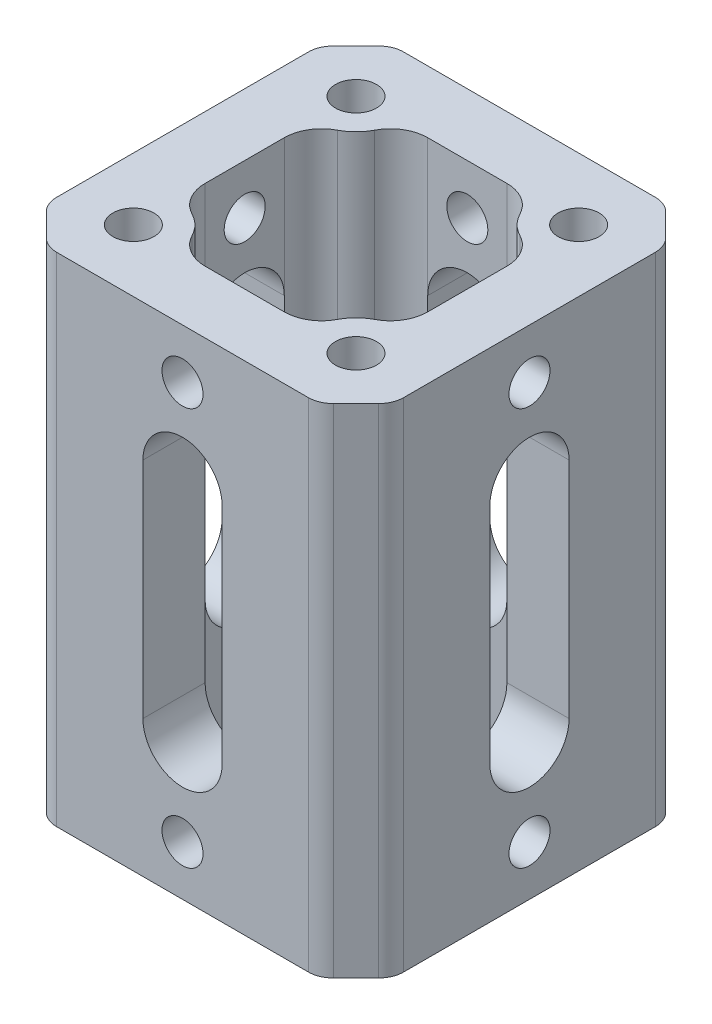
from build123d import *

# Parameters (mm, degrees)
SKETCH_1_W          = 27.9
SKETCH_1_H          = 27.9
EXTRUDE_1_DEPTH     = 20
HOLE_WIZARD_M4_2_D  = 3.3
CUT_EXTRUDE_1_DEPTH = 46
CHAMFER_1_SIZE      = 3
HOLE_WIZARD_M4_3_D  = 3.3
HOLE_WIZARD_M4_4_D  = 3.3
FILLET_1_R          = 2
FILLET_2_R          = 3
CUT_EXTRUDE_2_DEPTH = 46
CUT_EXTRUDE_3_DEPTH = 46


with BuildPart() as part:
    # 草图1 → 凸台-拉伸1 (new, symmetric)
    with BuildSketch(Plane(origin=(0, 0, 0), x_dir=(1, 0, 0), z_dir=(0, 1, 0))):
        Rectangle(SKETCH_1_W, SKETCH_1_H)
    extrude(amount=EXTRUDE_1_DEPTH, both=True)

    # M4 螺纹孔2 (through all)
    with Locations(Plane(origin=(0, -20, 0), x_dir=(-1, 0, 0), z_dir=(0, -1, 0))):
        with Locations((8.95, -8.95), (8.95, 8.95), (-8.95, 8.95), (-8.95, -8.95)):
            Hole(HOLE_WIZARD_M4_2_D / 2)

    # 草图8 → 切除-拉伸1 (cut, symmetric)
    with BuildSketch(Plane.XZ.offset(20)):
        with BuildLine():
            ThreePointArc((-8.95, -5.45), (-6.475126266, -6.475126266), (-5.45, -8.95))
            Line((-5.45, -8.95), (5.45, -8.95))
            ThreePointArc((5.45, -8.95), (6.475126266, -6.475126266), (8.95, -5.45))
            Line((8.95, -5.45), (8.95, 5.45))
            ThreePointArc((8.95, 5.45), (6.475126266, 6.475126266), (5.45, 8.95))
            Line((5.45, 8.95), (-5.45, 8.95))
            ThreePointArc((-5.45, 8.95), (-6.475126266, 6.475126266), (-8.95, 5.45))
            Line((-8.95, 5.45), (-8.95, -5.45))
        make_face()
    extrude(amount=CUT_EXTRUDE_1_DEPTH, both=True, mode=Mode.SUBTRACT)

    # 倒角1
    chamfer_1_edges = [part.edges().sort_by_distance(p)[0] for p in [
        (13.95, 0, 13.95),
        (-13.95, 0, 13.95),
        (-13.95, 0, -13.95),
        (13.95, 0, -13.95),
    ]]
    chamfer(chamfer_1_edges, length=CHAMFER_1_SIZE)

    # M4 螺纹孔3 (through all)
    with Locations(Plane.ZY.offset(13.95)):
        with Locations((0, 16), (0, -16)):
            Hole(HOLE_WIZARD_M4_3_D / 2)

    # M4 螺纹孔4 (through all)
    with Locations(Plane.XY.offset(13.95)):
        with Locations((0, 16), (0, -16)):
            Hole(HOLE_WIZARD_M4_4_D / 2)

    # 圆角1
    fillet_1_edges = [part.edges().sort_by_distance(p)[0] for p in [
        (-13.95, 0, 10.95),
        (-13.95, 0, -10.95),
        (13.95, 0, -10.95),
        (13.95, 0, 10.95),
        (-10.95, 0, 13.95),
        (10.95, 0, 13.95),
        (-10.95, 0, -13.95),
        (10.95, 0, -13.95),
    ]]
    fillet(fillet_1_edges, radius=FILLET_1_R)

    # 圆角2
    fillet_2_edges = [part.edges().sort_by_distance(p)[0] for p in [
        (-8.95, 0, 5.45),
        (-5.45, 0, 8.95),
        (5.45, 0, 8.95),
        (8.95, 0, 5.45),
        (8.95, 0, -5.45),
        (5.45, 0, -8.95),
        (-5.45, 0, -8.95),
        (-8.95, 0, -5.45),
    ]]
    fillet(fillet_2_edges, radius=FILLET_2_R)

    # 草图15 → 切除-拉伸2 (cut, symmetric)
    with BuildSketch(Plane.ZY.offset(13.95)):
        with BuildLine():
            Line((-3.183718703, -9), (-3.183718703, 9))
            ThreePointArc((-3.183718703, 9), (0, 12.183718703), (3.183718703, 9))
            Line((3.183718703, 9), (3.183718703, -9))
            ThreePointArc((3.183718703, -9), (0, -12.183718703), (-3.183718703, -9))
        make_face()
    extrude(amount=CUT_EXTRUDE_2_DEPTH, both=True, mode=Mode.SUBTRACT)

    # 草图16 → 切除-拉伸3 (cut, symmetric)
    with BuildSketch(Plane(origin=(0, 0, -13.95), x_dir=(-1, 0, 0), z_dir=(0, 0, -1))):
        with BuildLine():
            Line((-3.183718703, -9), (-3.183718703, 9))
            ThreePointArc((-3.183718703, 9), (0, 12.183718703), (3.183718703, 9))
            Line((3.183718703, 9), (3.183718703, -9))
            ThreePointArc((3.183718703, -9), (0, -12.183718703), (-3.183718703, -9))
        make_face()
    extrude(amount=CUT_EXTRUDE_3_DEPTH, both=True, mode=Mode.SUBTRACT)


solid = part.part
